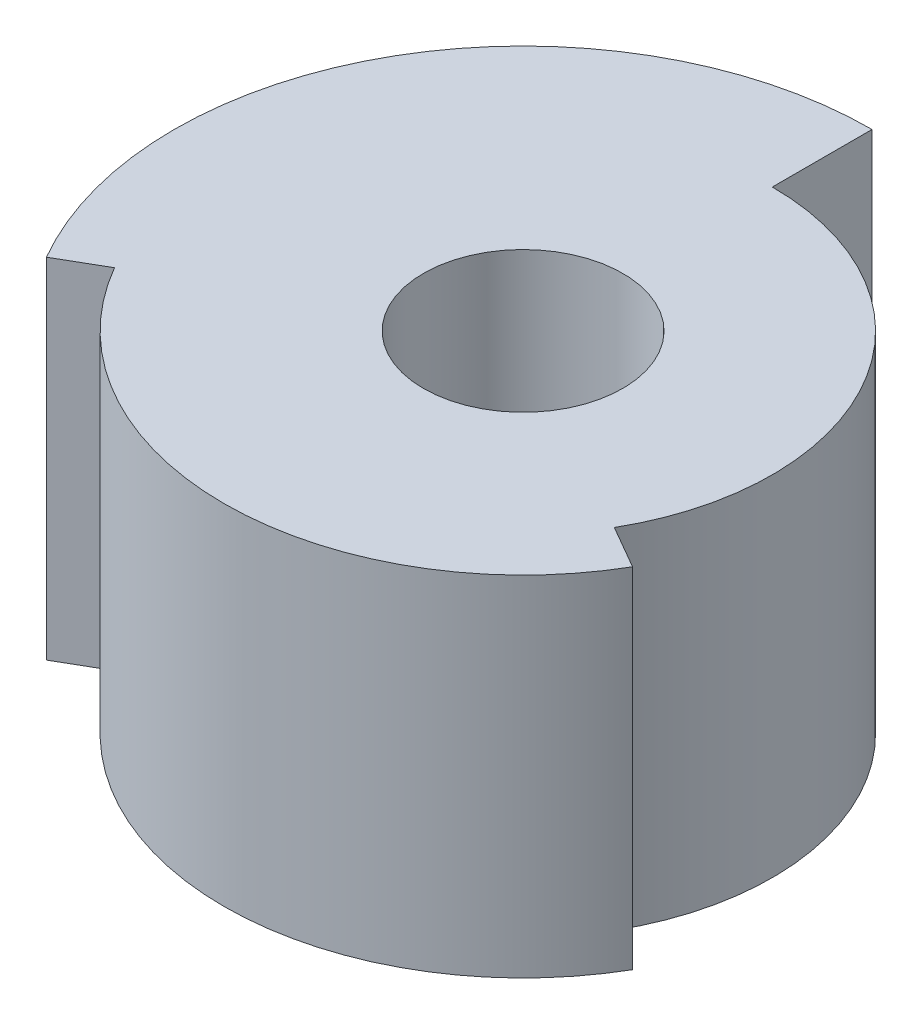
from build123d import *

# Parameters (mm, degrees)
SKETCH1_R           = 10
BOSS_EXTRUDE1_DEPTH = 35


with BuildPart() as part:
    # Sketch1 → Boss-Extrude1 (new body)
    with BuildSketch(Plane(origin=(0, 0, 0), x_dir=(1, 0, 0), z_dir=(0, 1, 0))):
        with BuildLine():
            Line((0, 25), (0, 30))
            Line((0, 30), (0, 35))
            ThreePointArc((0, 35), (-30.310889132, 17.5), (-30.310889132, -17.5))
            Line((-30.310889132, -17.5), (-25.980762114, -15))
            ThreePointArc((-25.980762114, -15), (0, -30), (25.980762114, -15))
            Line((25.980762114, -15), (21.650635095, -12.5))
            ThreePointArc((21.650635095, -12.5), (21.650635095, 12.5), (0, 25))
        make_face()
        with Locations(Location((0, 0, 0), (0, 0, 270))):
            Circle(SKETCH1_R, mode=Mode.SUBTRACT)
    extrude(amount=BOSS_EXTRUDE1_DEPTH)


solid = part.part
